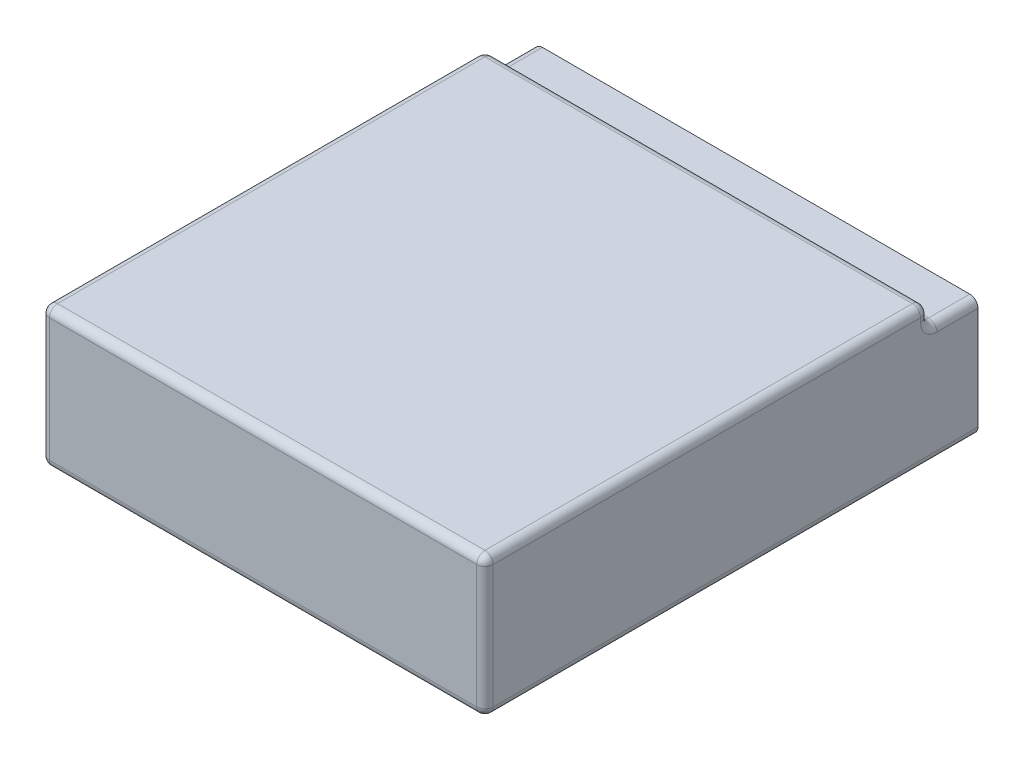
from build123d import *

# Parameters (mm, degrees)
SKETCH1_W           = 54
SKETCH1_H           = 60
BOSS_EXTRUDE1_DEPTH = 17
SKETCH2_W           = 54
SKETCH2_H           = 6
CUT_EXTRUDE1_DEPTH  = 2.5
FILLET1_R           = 1


with BuildPart() as part:
    # Sketch1 → Boss-Extrude1 (new body)
    with BuildSketch(Plane(origin=(0, 0, 0), x_dir=(1, 0, 0), z_dir=(0, 1, 0))):
        with Locations((-2.044526592, -0.229360244)):
            Rectangle(SKETCH1_W, SKETCH1_H)
    extrude(amount=BOSS_EXTRUDE1_DEPTH)

    # Sketch2 → Cut-Extrude1 (cut)
    with BuildSketch(Plane(origin=(0, 17, 0), x_dir=(1, 0, 0), z_dir=(0, 1, 0))):
        with Locations((-2.044526592, 26.770639756)):
            Rectangle(SKETCH2_W, SKETCH2_H)
    extrude(amount=-CUT_EXTRUDE1_DEPTH, mode=Mode.SUBTRACT)

    # Fillet1
    fillet1_edges = [part.edges().sort_by_distance(p)[0] for p in [
        (24.955473408, 17, 3.229360244),
        (-29.044526592, 17, 3.229360244),
        (-29.044526592, 14.5, -26.770639756),
        (-29.044526592, 15.75, -23.770639756),
        (24.955473408, 14.5, -26.770639756),
        (-2.044526592, 14.5, -23.770639756),
        (24.955473408, 15.75, -23.770639756),
        (-2.044526592, 17, -23.770639756),
        (24.955473408, 0, 0.229360244),
        (-2.044526592, 0, 30.229360244),
        (-29.044526592, 0, 0.229360244),
        (-2.044526592, 17, 30.229360244),
        (24.955473408, 8.5, 30.229360244),
        (-29.044526592, 8.5, 30.229360244),
    ]]
    fillet(fillet1_edges, radius=FILLET1_R)


solid = part.part
